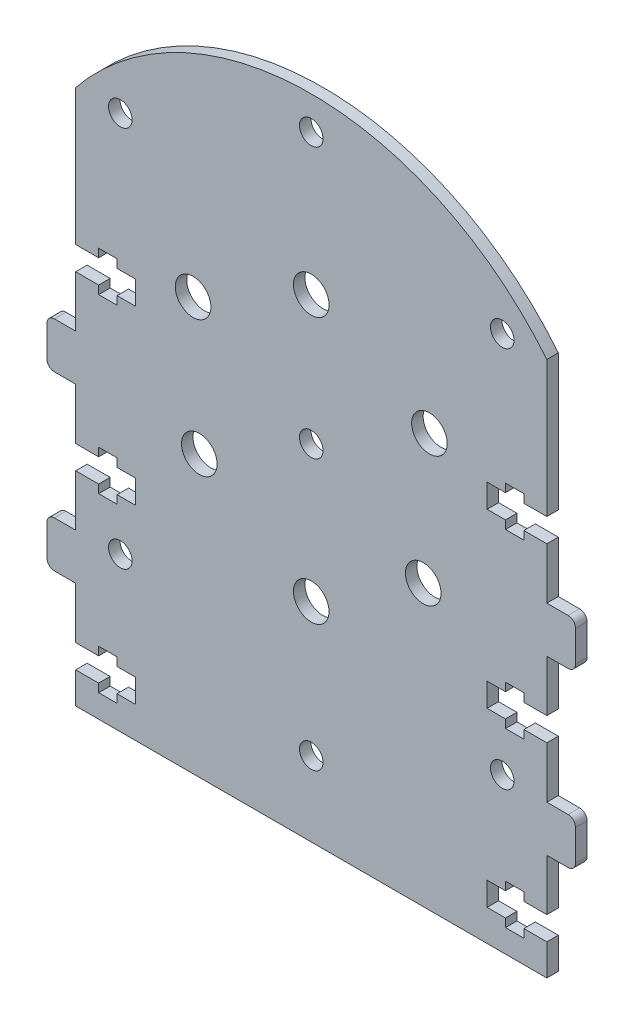
from build123d import *

# Parameters (mm, degrees)
SKETCH_1_R      = 3.1
SKETCH_1_R_2    = 2.05
EXTRUDE_2_DEPTH = 2
FILLET_1_R      = 1.3


with BuildPart() as part:
    # 草图1 → 凸台-拉伸2 (new body)
    with BuildSketch(Plane.XY):
        with BuildLine():
            Line((26.037512023, -61.503506411), (-55.962487977, -61.503506411))
            Line((-55.962487977, -61.503506411), (-55.962487977, -56.053506411))
            Line((-55.962487977, -56.053506411), (-51.962487977, -56.053506411))
            Line((-51.962487977, -56.053506411), (-51.962487977, -57.503506411))
            Line((-51.962487977, -57.503506411), (-48.762487977, -57.503506411))
            Line((-48.762487977, -57.503506411), (-48.762487977, -56.053506411))
            Line((-48.762487977, -56.053506411), (-45.562487977, -56.053506411))
            Line((-45.562487977, -56.053506411), (-45.562487977, -51.953506411))
            Line((-45.562487977, -51.953506411), (-48.762487977, -51.953506411))
            Line((-48.762487977, -51.953506411), (-48.762487977, -50.503506411))
            Line((-48.762487977, -50.503506411), (-51.962487977, -50.503506411))
            Line((-51.962487977, -50.503506411), (-51.962487977, -51.953506411))
            Line((-51.962487977, -51.953506411), (-55.962487977, -51.953506411))
            Line((-55.962487977, -51.953506411), (-55.962487977, -43.003506411))
            Line((-55.962487977, -43.003506411), (-60.962487977, -43.003506411))
            Line((-60.962487977, -43.003506411), (-60.962487977, -35.003506411))
            Line((-60.962487977, -35.003506411), (-55.962487977, -35.003506411))
            Line((-55.962487977, -35.003506411), (-55.962487977, -26.053506411))
            Line((-55.962487977, -26.053506411), (-51.962487977, -26.053506411))
            Line((-51.962487977, -26.053506411), (-51.962487977, -27.503506411))
            Line((-51.962487977, -27.503506411), (-48.762487977, -27.503506411))
            Line((-48.762487977, -27.503506411), (-48.762487977, -26.053506411))
            Line((-48.762487977, -26.053506411), (-45.562487977, -26.053506411))
            Line((-45.562487977, -26.053506411), (-45.562487977, -21.953506411))
            Line((-45.562487977, -21.953506411), (-48.762487977, -21.953506411))
            Line((-48.762487977, -21.953506411), (-48.762487977, -20.503506411))
            Line((-48.762487977, -20.503506411), (-51.962487977, -20.503506411))
            Line((-51.962487977, -20.503506411), (-51.962487977, -21.953506411))
            Line((-51.962487977, -21.953506411), (-55.962487977, -21.953506411))
            Line((-55.962487977, -21.953506411), (-55.962487977, -13.003506411))
            Line((-55.962487977, -13.003506411), (-60.962487977, -13.003506411))
            Line((-60.962487977, -13.003506411), (-60.962487977, -5.003506411))
            Line((-60.962487977, -5.003506411), (-55.962487977, -5.003506411))
            Line((-55.962487977, -5.003506411), (-55.962487977, 3.946493589))
            Line((-55.962487977, 3.946493589), (-51.962487977, 3.946493589))
            Line((-51.962487977, 3.946493589), (-51.962487977, 2.496493589))
            Line((-51.962487977, 2.496493589), (-48.762487977, 2.496493589))
            Line((-48.762487977, 2.496493589), (-48.762487977, 3.946493589))
            Line((-48.762487977, 3.946493589), (-45.562487977, 3.946493589))
            Line((-45.562487977, 3.946493589), (-45.562487977, 8.046493589))
            Line((-45.562487977, 8.046493589), (-48.762487977, 8.046493589))
            Line((-48.762487977, 8.046493589), (-48.762487977, 9.496493589))
            Line((-48.762487977, 9.496493589), (-51.962487977, 9.496493589))
            Line((-51.962487977, 9.496493589), (-51.962487977, 8.046493589))
            Line((-51.962487977, 8.046493589), (-55.962487977, 8.046493589))
            Line((-55.962487977, 8.046493589), (-55.962487977, 23.496493589))
            Line((-55.962487977, 23.496493589), (-55.962487977, 31.722989041))
            ThreePointArc((-55.962487977, 31.722989041), (-14.962487977, 51.269592797), (26.037512023, 31.722989041))
            Line((26.037512023, 31.722989041), (26.037512023, 23.496493589))
            Line((26.037512023, 23.496493589), (26.037512023, 8.046493589))
            Line((26.037512023, 8.046493589), (22.037512023, 8.046493589))
            Line((22.037512023, 8.046493589), (22.037512023, 9.496493589))
            Line((22.037512023, 9.496493589), (18.837512023, 9.496493589))
            Line((18.837512023, 9.496493589), (18.837512023, 8.046493589))
            Line((18.837512023, 8.046493589), (15.637512023, 8.046493589))
            Line((15.637512023, 8.046493589), (15.637512023, 3.946493589))
            Line((15.637512023, 3.946493589), (18.837512023, 3.946493589))
            Line((18.837512023, 3.946493589), (18.837512023, 2.496493589))
            Line((18.837512023, 2.496493589), (22.037512023, 2.496493589))
            Line((22.037512023, 2.496493589), (22.037512023, 3.946493589))
            Line((22.037512023, 3.946493589), (26.037512023, 3.946493589))
            Line((26.037512023, 3.946493589), (26.037512023, -5.003506411))
            Line((26.037512023, -5.003506411), (31.037512023, -5.003506411))
            Line((31.037512023, -5.003506411), (31.037512023, -13.003506411))
            Line((31.037512023, -13.003506411), (26.037512023, -13.003506411))
            Line((26.037512023, -13.003506411), (26.037512023, -21.953506411))
            Line((26.037512023, -21.953506411), (22.037512023, -21.953506411))
            Line((22.037512023, -21.953506411), (22.037512023, -20.503506411))
            Line((22.037512023, -20.503506411), (18.837512023, -20.503506411))
            Line((18.837512023, -20.503506411), (18.837512023, -21.953506411))
            Line((18.837512023, -21.953506411), (15.637512023, -21.953506411))
            Line((15.637512023, -21.953506411), (15.637512023, -26.053506411))
            Line((15.637512023, -26.053506411), (18.837512023, -26.053506411))
            Line((18.837512023, -26.053506411), (18.837512023, -27.503506411))
            Line((18.837512023, -27.503506411), (22.037512023, -27.503506411))
            Line((22.037512023, -27.503506411), (22.037512023, -26.053506411))
            Line((22.037512023, -26.053506411), (26.037512023, -26.053506411))
            Line((26.037512023, -26.053506411), (26.037512023, -35.003506411))
            Line((26.037512023, -35.003506411), (31.037512023, -35.003506411))
            Line((31.037512023, -35.003506411), (31.037512023, -43.003506411))
            Line((31.037512023, -43.003506411), (26.037512023, -43.003506411))
            Line((26.037512023, -43.003506411), (26.037512023, -51.953506411))
            Line((26.037512023, -51.953506411), (22.037512023, -51.953506411))
            Line((22.037512023, -51.953506411), (22.037512023, -50.503506411))
            Line((22.037512023, -50.503506411), (18.837512023, -50.503506411))
            Line((18.837512023, -50.503506411), (18.837512023, -51.953506411))
            Line((18.837512023, -51.953506411), (15.637512023, -51.953506411))
            Line((15.637512023, -51.953506411), (15.637512023, -56.053506411))
            Line((15.637512023, -56.053506411), (18.837512023, -56.053506411))
            Line((18.837512023, -56.053506411), (18.837512023, -57.503506411))
            Line((18.837512023, -57.503506411), (22.037512023, -57.503506411))
            Line((22.037512023, -57.503506411), (22.037512023, -56.053506411))
            Line((22.037512023, -56.053506411), (26.037512023, -56.053506411))
            Line((26.037512023, -56.053506411), (26.037512023, -61.503506411))
        make_face()
        with Locations((-14.962487977, -25.253506411)):
            Circle(SKETCH_1_R, mode=Mode.SUBTRACT)
        with Locations((4.523083608, -12.753506411)):
            Circle(SKETCH_1_R, mode=Mode.SUBTRACT)
        with Locations((-14.962487977, -1.503506411)):
            Circle(SKETCH_1_R_2, mode=Mode.SUBTRACT)
        with Locations((-35.530591317, 10.371493589)):
            Circle(SKETCH_1_R, mode=Mode.SUBTRACT)
        with Locations((-34.448059562, -12.753506411)):
            Circle(SKETCH_1_R, mode=Mode.SUBTRACT)
        with Locations((5.605615363, 10.371493589)):
            Circle(SKETCH_1_R, mode=Mode.SUBTRACT)
        with Locations((-14.962487977, 20.996493589)):
            Circle(SKETCH_1_R, mode=Mode.SUBTRACT)
        with Locations((18.271530739, -34.737525127)):
            Circle(SKETCH_1_R_2, mode=Mode.SUBTRACT)
        with Locations((-14.962487977, -48.503506411)):
            Circle(SKETCH_1_R_2, mode=Mode.SUBTRACT)
        with Locations((-48.196506692, -34.737525127)):
            Circle(SKETCH_1_R_2, mode=Mode.SUBTRACT)
        with Locations((-48.196506692, 31.730512305)):
            Circle(SKETCH_1_R_2, mode=Mode.SUBTRACT)
        with Locations((-14.962487977, 45.496493589)):
            Circle(SKETCH_1_R_2, mode=Mode.SUBTRACT)
        with Locations((18.271530739, 31.730512305)):
            Circle(SKETCH_1_R_2, mode=Mode.SUBTRACT)
    extrude(amount=EXTRUDE_2_DEPTH)

    # 圆角1
    fillet_1_edges = [part.edges().sort_by_distance(p)[0] for p in [
        (-60.962487977, -43.003506411, 1),
        (-60.962487977, -35.003506411, 1),
        (-60.962487977, -13.003506411, 1),
        (-60.962487977, -5.003506411, 1),
        (31.037512023, -5.003506411, 1),
        (31.037512023, -13.003506411, 1),
        (31.037512023, -35.003506411, 1),
        (31.037512023, -43.003506411, 1),
    ]]
    fillet(fillet_1_edges, radius=FILLET_1_R)


solid = part.part
